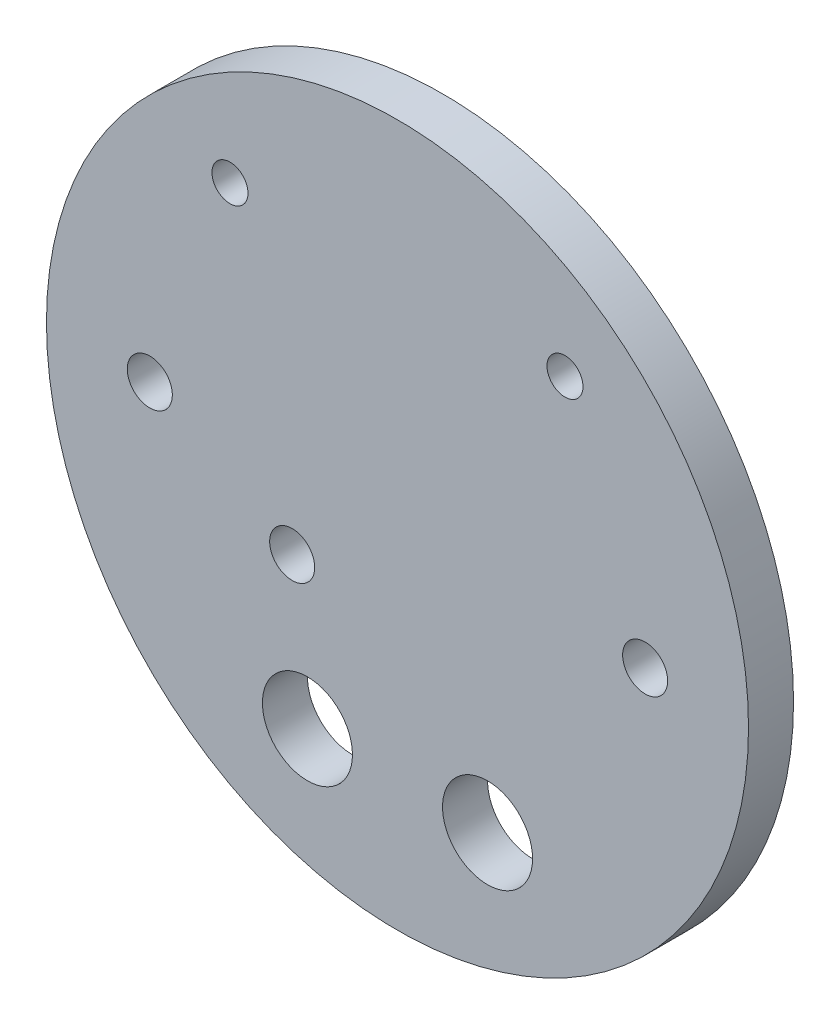
from build123d import *

# Parameters (mm, degrees)
SKETCH1_R           = 49.5046
BOSS_EXTRUDE1_DEPTH = 3.175
SKETCH2_R           = 47.6885
BOSS_EXTRUDE2_DEPTH = 3.175
SKETCH3_R           = 6.35
SKETCH3_R_2         = 3.175
SKETCH3_R_3         = 11.1125
SKETCH3_R_4         = 2.54
CUT_EXTRUDE1_DEPTH  = 71.297463271
BOSS_EXTRUDE3_START = -3.175
SKETCH4_R           = 49.5046
SKETCH4_R_2         = 47.6885
BOSS_EXTRUDE3_DEPTH = 3.175
SKETCH5_R           = 11.1125
BOSS_EXTRUDE4_DEPTH = 6.35
SKETCH6_R           = 2.54
BOSS_EXTRUDE5_DEPTH = 6.35


with BuildPart() as part:
    # Sketch1 → Boss-Extrude1 (new body)
    with BuildSketch(Plane.XY):
        Circle(SKETCH1_R)
    extrude(amount=BOSS_EXTRUDE1_DEPTH)

    # Sketch2 → Boss-Extrude2 (add)
    with BuildSketch(Plane.XY.offset(3.175)):
        Circle(SKETCH2_R)
    extrude(amount=BOSS_EXTRUDE2_DEPTH)

    # Sketch3 → Cut-Extrude1 (cut, through all)
    with BuildSketch(Plane.XY.offset(6.35)):
        with Locations((-12.7, -31.235352443)):
            Circle(SKETCH3_R)
        with Locations((12.7, -31.235352443)):
            Circle(SKETCH3_R)
        with Locations((-34.925, 0)):
            Circle(SKETCH3_R_2)
        with Locations((34.925, 0)):
            Circle(SKETCH3_R_2)
        with Locations((0, 6.35)):
            Circle(SKETCH3_R_3)
        with Locations((-14.850390051, -11.029456704)):
            Circle(SKETCH3_R_2)
        with Locations((-23.622, 29.972)):
            Circle(SKETCH3_R_4)
        with Locations((23.622, 29.972)):
            Circle(SKETCH3_R_4)
        with Locations((23.622, -17.272)):
            Circle(SKETCH3_R_4)
        with Locations((-23.622, -17.272)):
            Circle(SKETCH3_R_4)
    extrude(amount=-CUT_EXTRUDE1_DEPTH, mode=Mode.SUBTRACT)

    # Sketch4 → Boss-Extrude3 (add)
    with BuildSketch(Plane.XY.offset(6.35).offset(BOSS_EXTRUDE3_START)):
        Circle(SKETCH4_R)
        Circle(SKETCH4_R_2, mode=Mode.SUBTRACT)
    extrude(amount=BOSS_EXTRUDE3_DEPTH)

    # Sketch5 → Boss-Extrude4 (add)
    with BuildSketch(Plane.XY.offset(6.35)):
        with Locations((0, 6.35)):
            Circle(SKETCH5_R)
    extrude(amount=-BOSS_EXTRUDE4_DEPTH)

    # Sketch6 → Boss-Extrude5 (add)
    with BuildSketch(Plane.XY.offset(6.35)):
        with Locations((-23.622, -17.272)):
            Circle(SKETCH6_R)
        with Locations((23.622, -17.272)):
            Circle(SKETCH6_R)
    extrude(amount=-BOSS_EXTRUDE5_DEPTH)


solid = part.part
